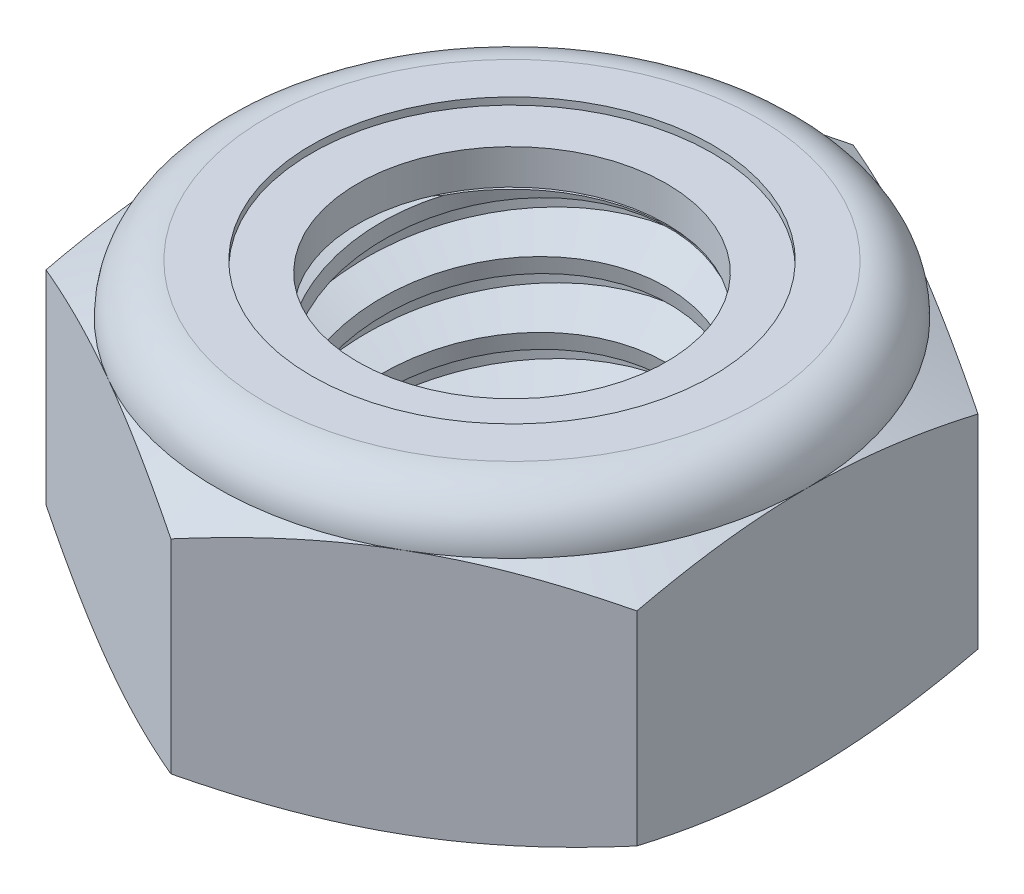
from build123d import *

# Parameters (mm, degrees)
EXTRUDE1_DEPTH      = 6.35
SKETCH2_W           = 3.9624
SKETCH2_H           = 6.35
LPATTERN1_COUNT     = 5
LPATTERN1_PITCH     = 1.411111111
LPATTERN1_COL_COUNT = 2
LPATTERN1_COL_PITCH = 1.411111111


with BuildPart() as part:
    # Sketch1 → Extrude1 (new body)
    with BuildSketch(Plane(origin=(0, 0, 0), x_dir=(1, 0, 0), z_dir=(0, 1, 0))):
        Polygon((0, 7.332348419), (-6.35, 3.666174209), (-6.35, -3.666174209), (0, -7.332348419), (6.35, -3.666174209), (6.35, 3.666174209), align=None)
    extrude(amount=EXTRUDE1_DEPTH)

    # Sketch4 → Cut-Revolve2 (revolve, cut)
    with BuildSketch(Plane(origin=(0, 0, 0), x_dir=(0, 0, -1), z_dir=(1, 0, 0))):
        Polygon((0, 6.35), (3.9624, 6.35), (3.318668226, 6.049822944), (3.318668226, 0.300177056), (3.9624, 0), (0, 0), align=None)
    revolve(axis=Axis((0, 6.35, 0), (0, 1, 0)), mode=Mode.SUBTRACT)


with BuildPart() as body_2:
    # Sketch2 → Revolve1 (revolve)
    with BuildSketch(Plane(origin=(0, 0, 0), x_dir=(0, 0, -1), z_dir=(1, 0, 0))):
        with Locations((1.9812, 3.175)):
            Rectangle(SKETCH2_W, SKETCH2_H)
    revolve(axis=Axis((0, -3.9624, 0), (0, 1, 0)))

    # Sketch3 → Cut-Revolve1 (revolve, cut)
    with BuildSketch(Plane(origin=(0, 0, 0), x_dir=(0, 0, -1), z_dir=(1, 0, 0)), mode=Mode.PRIVATE) as cut_revolve1_sk:
        Polygon((3.993321894, 6.176342646), (4.209775148, 4.960741167), (3.380512014, 5.260988826), (3.318668226, 5.608303534), align=None)
    cut_revolve1 = revolve(cut_revolve1_sk.sketch.rotate(Axis((0, 6.35, 0.26919352), (0, -0.9845141333311523, -0.17530522317150163)), 180), axis=Axis((0, 6.35, 0.26919352), (0, -0.9845141333311523, -0.17530522317150163)), mode=Mode.SUBTRACT)

    # LPattern1: Cut-Revolve1 ×5
    with Locations(*[(0, -i * LPATTERN1_PITCH, 0) for i in range(1, LPATTERN1_COUNT)]):
        add(cut_revolve1, mode=Mode.SUBTRACT)

    # LPattern1 col: Cut-Revolve1 ×2
    with Locations(*[(0, i * LPATTERN1_COL_PITCH, 0) for i in range(1, LPATTERN1_COL_COUNT)]):
        add(cut_revolve1, mode=Mode.SUBTRACT)


with BuildPart() as part_1:
    add(part.part)

    # Combine1: cut body 2
    add(body_2.part, mode=Mode.SUBTRACT)

    # Sketch5 → Cut-Revolve3 (revolve, cut)
    with BuildSketch(Plane(origin=(0, 0, 0), x_dir=(0, 0, -1), z_dir=(1, 0, 0)), mode=Mode.PRIVATE) as cut_revolve3_sk:
        with BuildLine():
            Line((0, 0), (6.35, 0))
            Line((6.35, 0), (7.332348419, 0.458076591))
            Line((7.332348419, 0.458076591), (7.332348419, 4.833590076))
            Line((7.332348419, 4.833590076), (6.35, 5.291666667))
            ThreePointArc((6.35, 5.291666667), (6.040021343, 6.040021343), (5.291666667, 6.35))
            Line((5.291666667, 6.35), (5.291666667, 7.62))
            Line((5.291666667, 7.62), (8.602348419, 7.62))
            Line((8.602348419, 7.62), (8.602348419, -1.27))
            Line((8.602348419, -1.27), (0, -1.27))
            Line((0, -1.27), (0, 0))
        make_face()
    revolve(cut_revolve3_sk.sketch.rotate(Axis((0, 0, 0), (0, 1, 0)), 54.613905467), axis=Axis((0, 0, 0), (0, 1, 0)), mode=Mode.SUBTRACT)

    # Sketch6 → Cut-Revolve4 (revolve, cut)
    with BuildSketch(Plane(origin=(0, 0, 0), x_dir=(0, 0, -1), z_dir=(1, 0, 0)), mode=Mode.PRIVATE) as cut_revolve4_sk:
        with BuildLine():
            Line((0, 5.291666667), (6.1976, 5.291666667))
            ThreePointArc((6.1976, 5.291666667), (5.93225827, 5.93225827), (5.291666667, 6.1976))
            Line((5.291666667, 6.1976), (4.305167447, 6.1976))
            Line((4.305167447, 6.1976), (4.305167447, 7.62))
            Line((4.305167447, 7.62), (0, 7.62))
            Line((0, 7.62), (0, 5.291666667))
        make_face()
    revolve(cut_revolve4_sk.sketch.rotate(Axis((0, 7.62, 0), (0, 1, 0)), 54.613905467), axis=Axis((0, 7.62, 0), (0, 1, 0)), mode=Mode.SUBTRACT)


with BuildPart() as body_2_2:
    # Sketch7 → Revolve2 (revolve)
    with BuildSketch(Plane(origin=(0, 0, 0), x_dir=(0, 0, -1), z_dir=(1, 0, 0))):
        with BuildLine():
            Line((3.318668226, 5.367866667), (6.117893612, 5.367866667))
            ThreePointArc((6.117893612, 5.367866667), (5.850787282, 5.904725834), (5.291666667, 6.1214))
            Line((5.291666667, 6.1214), (3.318668226, 6.1214))
            Line((3.318668226, 6.1214), (3.318668226, 5.367866667))
        make_face()
    revolve(axis=Axis((0, 5.367866667, 0), (0, 1, 0)))


solid = Compound([part_1.part, body_2_2.part])
